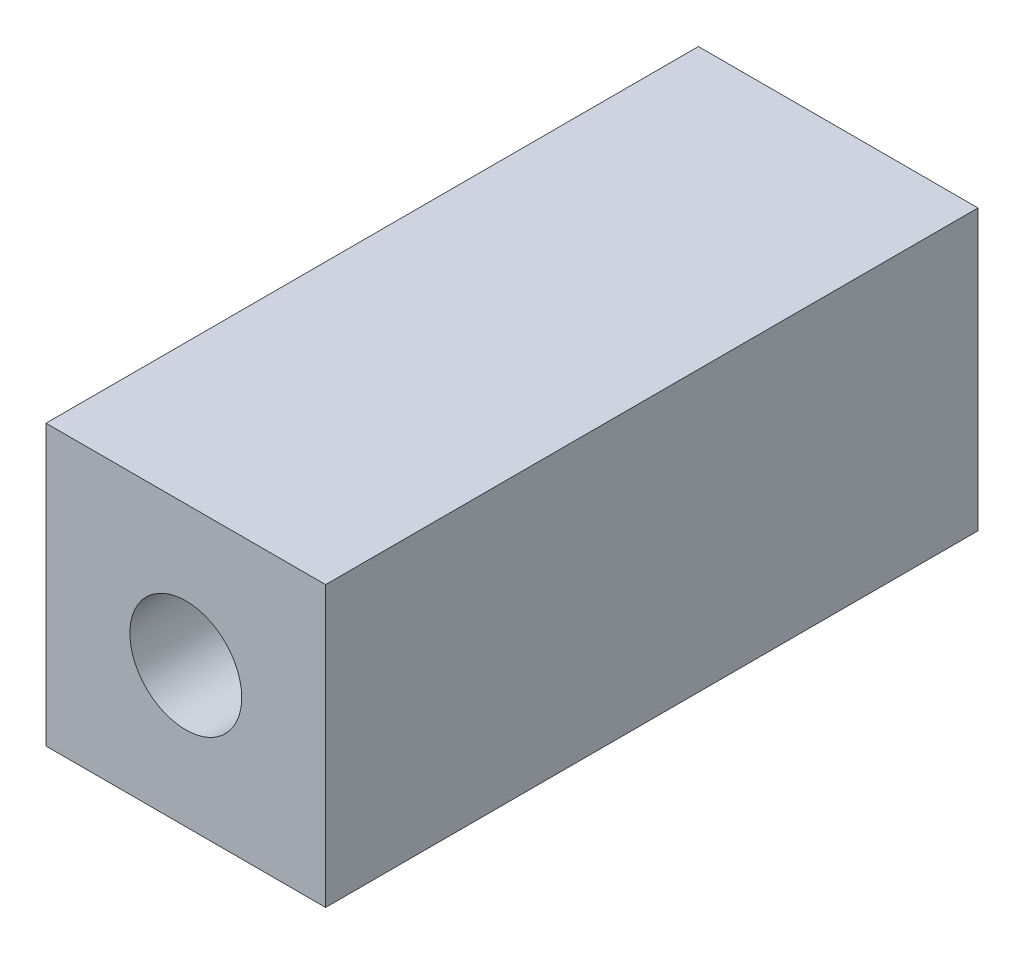
from build123d import *

# Parameters (mm, degrees)
BOSS_EXTRUDE1_DEPTH = 70
SKETCH2_R           = 6
CUT_EXTRUDE1_DEPTH  = 74.143694192


with BuildPart() as part:
    # Sketch1 → Boss-Extrude1 (new body)
    with BuildSketch(Plane.XY):
        Polygon((-15, 0), (-15, 15), (15, 15), (15, -15), (-15, -15), align=None)
    extrude(amount=BOSS_EXTRUDE1_DEPTH)

    # Sketch2 → Cut-Extrude1 (cut, through all)
    with BuildSketch(Plane.XY.offset(70)):
        Circle(SKETCH2_R)
    extrude(amount=-CUT_EXTRUDE1_DEPTH, mode=Mode.SUBTRACT)


solid = part.part
